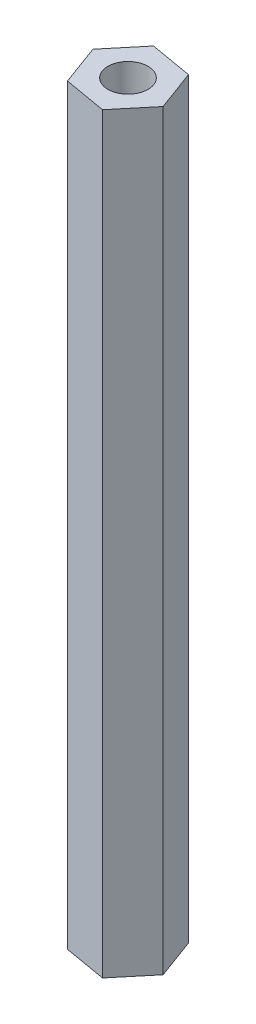
from build123d import *

# Parameters (mm, degrees)
SKETCH1_R           = 1.4
BOSS_EXTRUDE1_DEPTH = 52.5


with BuildPart() as part:
    # Sketch1 → Boss-Extrude1 (new body)
    with BuildSketch(Plane(origin=(0, 0, 0), x_dir=(1, 0, 0), z_dir=(0, 1, 0))):
        Polygon((1.03732279, -2.814953184), (2.956482363, -0.509128705), (1.919159573, 2.30582448), (-1.03732279, 2.814953184), (-2.956482363, 0.509128704), (-1.919159573, -2.30582448), align=None)
        with Locations(Location((0, 0, 0), (0, 0, 270))):
            Circle(SKETCH1_R, mode=Mode.SUBTRACT)
    extrude(amount=BOSS_EXTRUDE1_DEPTH)


solid = part.part
